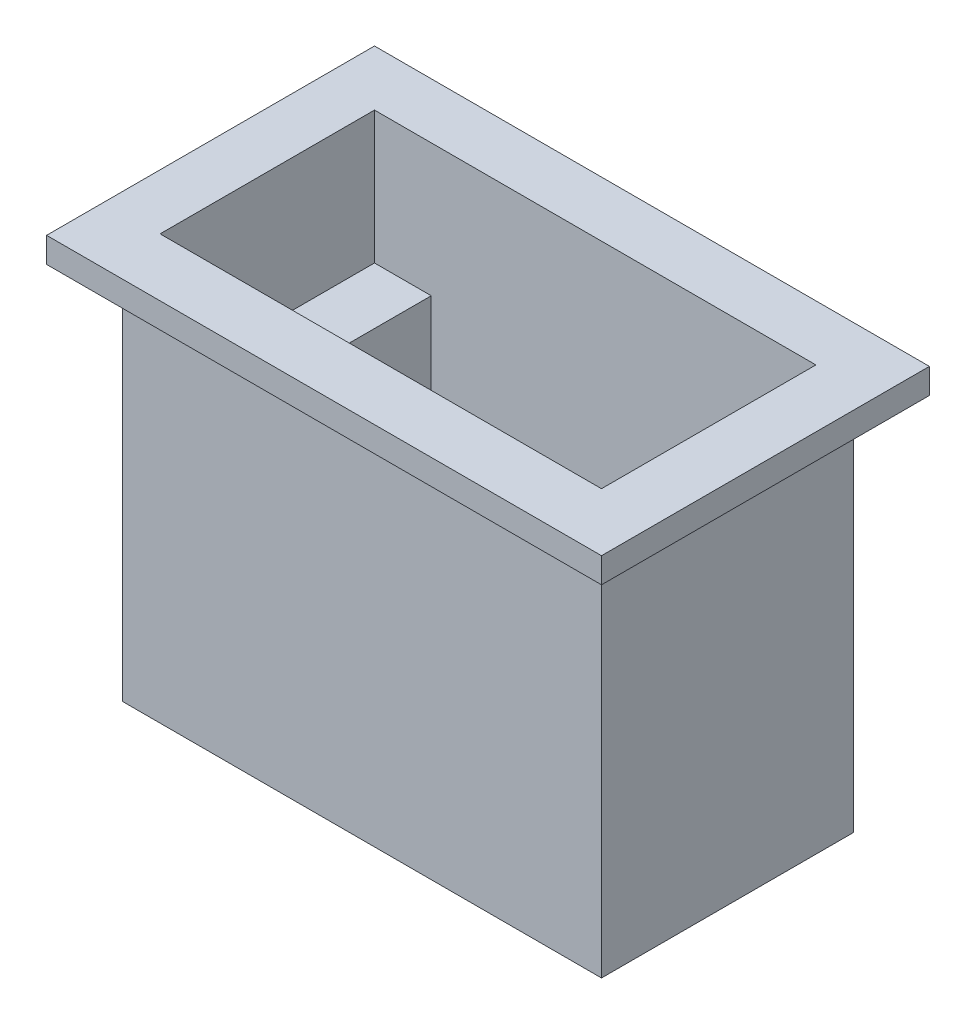
from build123d import *

# Parameters (mm, degrees)
SKETCH1_W           = 38
SKETCH1_H           = 20
BOSS_EXTRUDE1_DEPTH = 32
SKETCH2_W           = 35
SKETCH2_H           = 17
CUT_EXTRUDE1_DEPTH  = 28
SKETCH3_W           = 4.5
SKETCH3_H           = 17
SKETCH3_W_2         = 6
BOSS_EXTRUDE2_DEPTH = 17.5
SKETCH4_W           = 44
SKETCH4_H           = 26
SKETCH4_W_2         = 38
SKETCH4_H_2         = 20
EXTRUDE_THIN2_DEPTH = 2


with BuildPart() as part:
    # Sketch1 → Boss-Extrude1 (new body)
    with BuildSketch(Plane(origin=(0, 0, 0), x_dir=(1, 0, 0), z_dir=(0, 1, 0))):
        with Locations((8.6, -4.057142857)):
            Rectangle(SKETCH1_W, SKETCH1_H)
    extrude(amount=BOSS_EXTRUDE1_DEPTH)

    # Sketch2 → Cut-Extrude1 (cut)
    with BuildSketch(Plane(origin=(0, 32, 0), x_dir=(1, 0, 0), z_dir=(0, 1, 0))):
        with Locations((8.5, -3.957142857)):
            Rectangle(SKETCH2_W, SKETCH2_H)
    extrude(amount=-CUT_EXTRUDE1_DEPTH, mode=Mode.SUBTRACT)

    # Sketch3 → Boss-Extrude2 (add)
    with BuildSketch(Plane(origin=(0, 4, 0), x_dir=(1, 0, 0), z_dir=(0, 1, 0))):
        with Locations((-6.75, -3.957142857)):
            Rectangle(SKETCH3_W, SKETCH3_H)
        with Locations((23, -3.957142857)):
            Rectangle(SKETCH3_W_2, SKETCH3_H)
    extrude(amount=BOSS_EXTRUDE2_DEPTH)

    # Sketch4 → Extrude-Thin2 (add)
    with BuildSketch(Plane(origin=(0, 32, 0), x_dir=(1, 0, 0), z_dir=(0, 1, 0))):
        with Locations((8.6, -4.057142857)):
            Rectangle(SKETCH4_W, SKETCH4_H)
        with Locations((8.6, -4.057142857)):
            Rectangle(SKETCH4_W_2, SKETCH4_H_2, mode=Mode.SUBTRACT)
    extrude(amount=-EXTRUDE_THIN2_DEPTH)


solid = part.part
